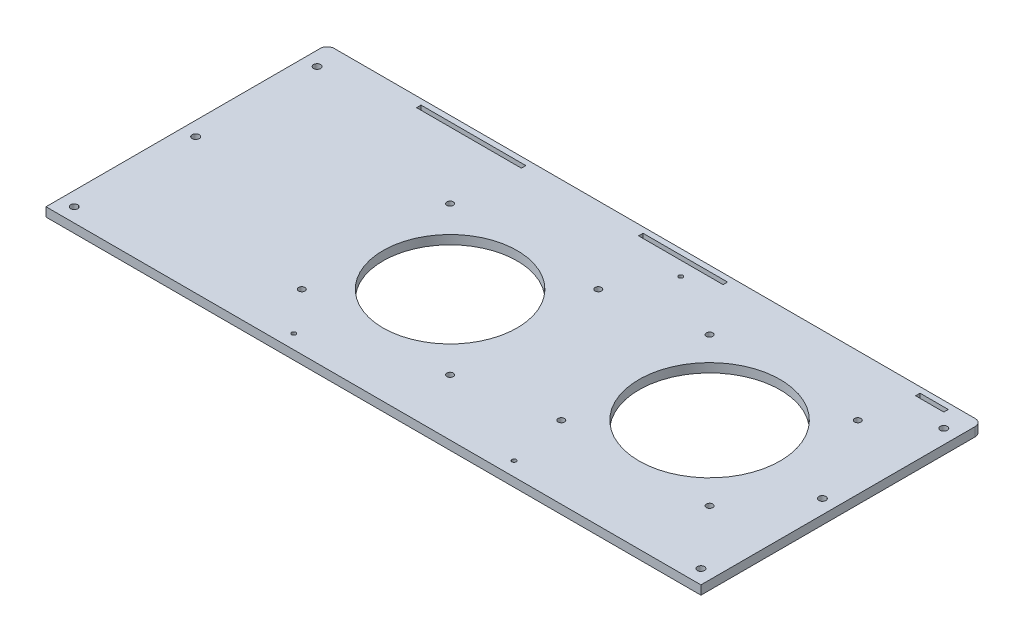
from build123d import *

# Parameters (mm, degrees)
SKETCH1_W           = 463.88
SKETCH1_H           = 192
BOSS_EXTRUDE1_DEPTH = 6.35
SKETCH4_R           = 2.5
CUT_EXTRUDE2_DEPTH  = 484.483469107
SKETCH2_W           = 463.88
SKETCH2_H           = 7.175
BOSS_EXTRUDE2_DEPTH = 6.35
SKETCH3_W           = 74.25
SKETCH3_H           = 3.175
SKETCH3_W_2         = 59.87
SKETCH3_W_3         = 20
CUT_EXTRUDE1_DEPTH  = 484.483469107
SKETCH5_R           = 1.5
CUT_EXTRUDE3_DEPTH  = 484.483469107
FILLET1_R           = 5
SKETCH6_R           = 47.5
SKETCH6_R_2         = 50
SKETCH6_R_3         = 2.25
CUT_EXTRUDE4_DEPTH  = 484.483469107


with BuildPart() as part:
    # Sketch1 → Boss-Extrude1 (new body)
    with BuildSketch(Plane(origin=(0, 60, 0), x_dir=(1, 0, 0), z_dir=(0, 1, 0))):
        with Locations((211.74, -96)):
            Rectangle(SKETCH1_W, SKETCH1_H)
    extrude(amount=BOSS_EXTRUDE1_DEPTH)

    # Sketch4 → Cut-Extrude2 (cut, through all)
    with BuildSketch(Plane(origin=(0, 66.35, 0), x_dir=(1, 0, 0), z_dir=(0, 1, 0))):
        with Locations(Location((433.68, -10, 0), (0, 0, 270))):
            Circle(SKETCH4_R)
        with Locations(Location((433.68, -96, 0), (0, 0, 270))):
            Circle(SKETCH4_R)
        with Locations(Location((433.68, -182, 0), (0, 0, 270))):
            Circle(SKETCH4_R)
        with Locations(Location((-10.2, -182, 0), (0, 0, 270))):
            Circle(SKETCH4_R)
        with Locations(Location((-10.2, -96, 0), (0, 0, 270))):
            Circle(SKETCH4_R)
        with Locations(Location((-10.2, -10, 0), (0, 0, 270))):
            Circle(SKETCH4_R)
    extrude(amount=-CUT_EXTRUDE2_DEPTH, mode=Mode.SUBTRACT)

    # Sketch2 → Boss-Extrude2 (add)
    with BuildSketch(Plane(origin=(0, 66.35, 0), x_dir=(1, 0, 0), z_dir=(0, 1, 0))):
        with Locations((211.74, 3.5875)):
            Rectangle(SKETCH2_W, SKETCH2_H)
    extrude(amount=-BOSS_EXTRUDE2_DEPTH)

    # Sketch3 → Cut-Extrude1 (cut, through all)
    with BuildSketch(Plane(origin=(0, 66.35, 0), x_dir=(1, 0, 0), z_dir=(0, 1, 0))):
        with Locations((87.375, 1.5875)):
            Rectangle(SKETCH3_W, SKETCH3_H)
        with Locations((237.435, 1.5875)):
            Rectangle(SKETCH3_W_2, SKETCH3_H)
        with Locations((413.68, 1.5875)):
            Rectangle(SKETCH3_W_3, SKETCH3_H)
    extrude(amount=-CUT_EXTRUDE1_DEPTH, mode=Mode.SUBTRACT)

    # Sketch5 → Cut-Extrude3 (cut, through all)
    with BuildSketch(Plane(origin=(0, 66.35, 0), x_dir=(1, 0, 0), z_dir=(0, 1, 0))):
        with Locations(Location((247.37, -10, 0), (0, 0, 270))):
            Circle(SKETCH5_R)
        with Locations(Location((145.287005384, -182, 0), (0, 0, 270))):
            Circle(SKETCH5_R)
        with Locations(Location((301.287005384, -182, 0), (0, 0, 270))):
            Circle(SKETCH5_R)
    extrude(amount=-CUT_EXTRUDE3_DEPTH, mode=Mode.SUBTRACT)

    # Fillet1
    fillet1_edges = [part.edges().sort_by_distance(p)[0] for p in [
        (-20.2, 63.175, -7.175),
        (443.68, 63.175, -7.175),
    ]]
    fillet(fillet1_edges, radius=FILLET1_R)

    # Sketch6 → Cut-Extrude4 (cut, through all)
    with BuildSketch(Plane(origin=(0, 66.35, 0), x_dir=(1, 0, 0), z_dir=(0, 1, 0))):
        with Locations(Location((173.5, -99.5, 0), (0, 0, 270))):
            Circle(SKETCH6_R)
        with Locations(Location((345.74, -87.95, 0), (0, 0, 270))):
            Circle(SKETCH6_R_2)
        with Locations(Location((121, -47, 0), (0, 0, 270))):
            Circle(SKETCH6_R_3)
        with Locations(Location((226, -47, 0), (0, 0, 270))):
            Circle(SKETCH6_R_3)
        with Locations(Location((226, -152, 0), (0, 0, 270))):
            Circle(SKETCH6_R_3)
        with Locations(Location((121, -152, 0), (0, 0, 270))):
            Circle(SKETCH6_R_3)
        with Locations(Location((293.24, -140.45, 0), (0, 0, 270))):
            Circle(SKETCH6_R_3)
        with Locations(Location((293.24, -35.45, 0), (0, 0, 270))):
            Circle(SKETCH6_R_3)
        with Locations(Location((398.24, -35.45, 0), (0, 0, 270))):
            Circle(SKETCH6_R_3)
        with Locations(Location((398.24, -140.45, 0), (0, 0, 270))):
            Circle(SKETCH6_R_3)
    extrude(amount=-CUT_EXTRUDE4_DEPTH, mode=Mode.SUBTRACT)


solid = part.part
